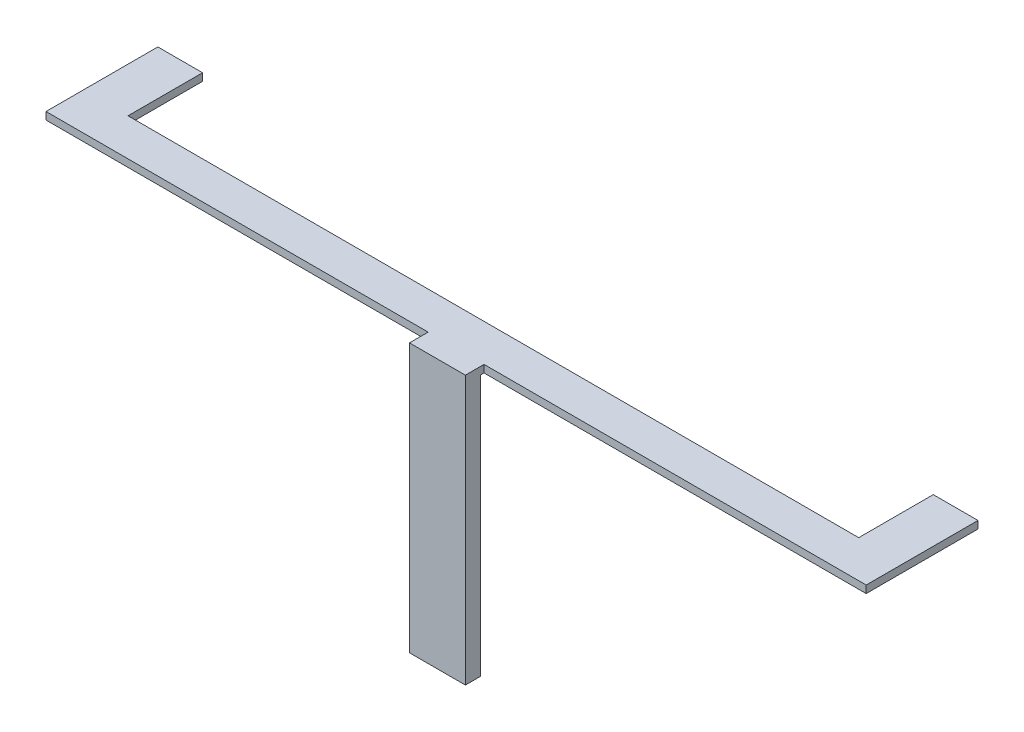
from build123d import *

# Parameters (mm, degrees)
SKETCH1_W           = 12
SKETCH1_H           = 20
BOSS_EXTRUDE1_DEPTH = 2
SKETCH2_W           = 15
SKETCH2_H           = 4
BOSS_EXTRUDE2_DEPTH = 70


with BuildPart() as part:
    # Sketch1 → Boss-Extrude1 (new body)
    with BuildSketch(Plane(origin=(0, 0, 0), x_dir=(1, 0, 0), z_dir=(0, 1, 0))):
        with Locations((6, 20)):
            Rectangle(SKETCH1_W, SKETCH1_H)
        Polygon((102.5, 0), (110, 0), (110, 10), (12, 10), (0, 10), (0, 0), align=None)
        Polygon((117.5, 0), (110, 0), (102.5, 0), (102.5, -5), (117.5, -5), align=None)
        Polygon((110, 10), (110, 0), (117.5, 0), (220, 0), (220, 10), (208, 10), align=None)
        with Locations((214, 20)):
            Rectangle(SKETCH1_W, SKETCH1_H)
    extrude(amount=BOSS_EXTRUDE1_DEPTH)

    # Sketch2 → Boss-Extrude2 (add)
    with BuildSketch(Plane.XZ):
        with Locations((110, 3)):
            Rectangle(SKETCH2_W, SKETCH2_H)
    extrude(amount=BOSS_EXTRUDE2_DEPTH)


solid = part.part
